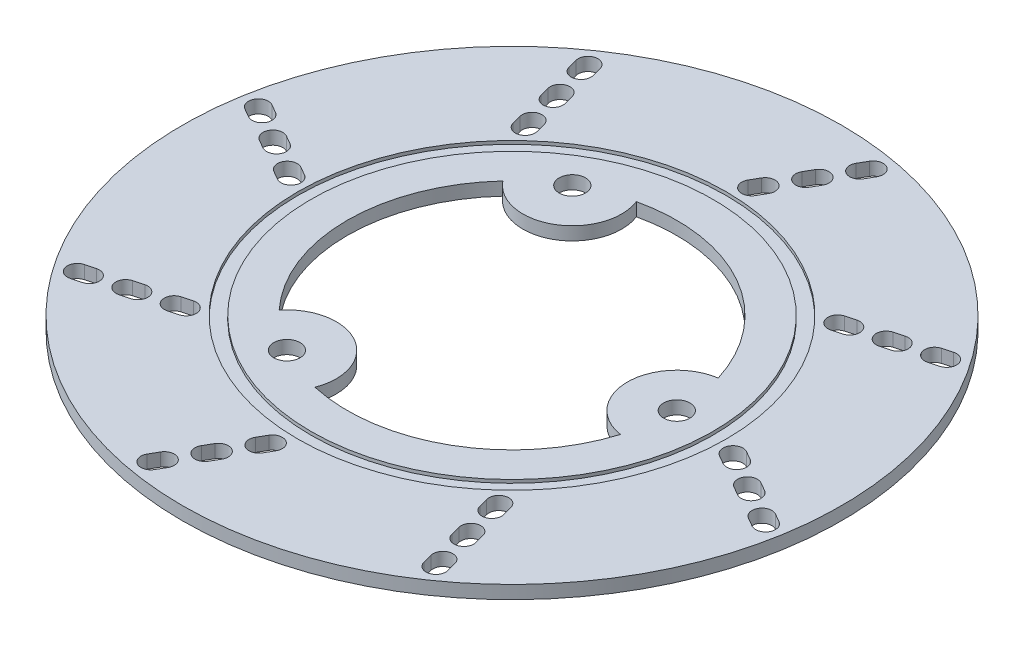
from build123d import *

# Parameters (mm, degrees)
SKETCH2_R           = 100
SKETCH2_R_2         = 4
BOSS_EXTRUDE1_DEPTH = 2
SKETCH3_R           = 65
SKETCH3_R_2         = 61
CUT_EXTRUDE2_DEPTH  = 1
CUT_EXTRUDE3_DEPTH  = 10


with BuildPart() as part:
    # Sketch2 → Boss-Extrude1 (new, symmetric)
    with BuildSketch(Plane(origin=(0, 0, 0), x_dir=(1, 0, 0), z_dir=(0, 1, 0))):
        Circle(SKETCH2_R)
        with Locations((50, 0)):
            Circle(SKETCH2_R_2, mode=Mode.SUBTRACT)
        with Locations((-25, -43.301270189)):
            Circle(SKETCH2_R_2, mode=Mode.SUBTRACT)
        with Locations((-25, 43.301270189)):
            Circle(SKETCH2_R_2, mode=Mode.SUBTRACT)
        with BuildLine():
            ThreePointArc((-36.718407842, 33.937568056), (-17.5, 30.310889132), (-11.031592158, 48.767858006))
            ThreePointArc((-11.031592158, 48.767858006), (25, 43.301270189), (47.75, 14.83028995))
            ThreePointArc((47.75, 14.83028995), (35, 0), (47.75, -14.83028995))
            ThreePointArc((47.75, -14.83028995), (25, -43.301270189), (-11.031592158, -48.767858006))
            ThreePointArc((-11.031592158, -48.767858006), (-17.5, -30.310889132), (-36.718407842, -33.937568056))
            ThreePointArc((-36.718407842, -33.937568056), (-50, 0), (-36.718407842, 33.937568056))
        make_face(mode=Mode.SUBTRACT)
    extrude(amount=BOSS_EXTRUDE1_DEPTH, both=True)

    # Sketch3 → Cut-Extrude2 (cut)
    with BuildSketch(Plane(origin=(0, 2, 0), x_dir=(1, 0, 0), z_dir=(0, 1, 0))):
        Circle(SKETCH3_R)
        Circle(SKETCH3_R_2, mode=Mode.SUBTRACT)
    extrude(amount=-CUT_EXTRUDE2_DEPTH, mode=Mode.SUBTRACT)

    # Sketch4 → Cut-Extrude3 (cut)
    with BuildSketch(Plane(origin=(0, 2, 0), x_dir=(1, 0, 0), z_dir=(0, 1, 0))):
        with BuildLine():
            Line((6.221861376, 81.776580022), (7.721861376, 84.374656233))
            ThreePointArc((7.721861376, 84.374656233), (11.819937588, 85.472732444), (12.918013799, 81.374656233))
            Line((12.918013799, 81.374656233), (11.418013799, 78.776580022))
            ThreePointArc((11.418013799, 78.776580022), (7.319937588, 77.67850381), (6.221861376, 81.776580022))
        make_face()
        with BuildLine():
            Line((0.221861376, 71.384275176), (1.721861376, 73.982351387))
            ThreePointArc((1.721861376, 73.982351387), (5.819937588, 75.080427599), (6.918013799, 70.982351387))
            Line((6.918013799, 70.982351387), (5.418013799, 68.384275176))
            ThreePointArc((5.418013799, 68.384275176), (1.319937588, 67.286198965), (0.221861376, 71.384275176))
        make_face()
        with BuildLine():
            Line((18.918013799, 91.766961078), (17.418013799, 89.168884867))
            ThreePointArc((17.418013799, 89.168884867), (13.319937588, 88.070808656), (12.221861376, 92.168884867))
            Line((12.221861376, 92.168884867), (13.721861376, 94.766961078))
            ThreePointArc((13.721861376, 94.766961078), (17.819937588, 95.86503729), (18.918013799, 91.766961078))
        make_face()
        with BuildLine():
            Line((-53.425253905, 62.224294646), (-54.20171104, 65.122072125))
            ThreePointArc((-54.20171104, 65.122072125), (-52.080390696, 68.796306739), (-48.406156082, 66.674986396))
            Line((-48.406156082, 66.674986396), (-47.629698947, 63.777208917))
            ThreePointArc((-47.629698947, 63.777208917), (-49.75101929, 60.102974303), (-53.425253905, 62.224294646))
        make_face()
        with BuildLine():
            Line((-50.319425363, 50.633184731), (-51.095882499, 53.53096221))
            ThreePointArc((-51.095882499, 53.53096221), (-48.974562155, 57.205196824), (-45.300327541, 55.08387648))
            Line((-45.300327541, 55.08387648), (-44.523870406, 52.186099001))
            ThreePointArc((-44.523870406, 52.186099001), (-46.645190749, 48.511864387), (-50.319425363, 50.633184731))
        make_face()
        with BuildLine():
            Line((-51.511984623, 78.266096311), (-50.735527488, 75.368318832))
            ThreePointArc((-50.735527488, 75.368318832), (-52.856847832, 71.694084218), (-56.531082446, 73.815404562))
            Line((-56.531082446, 73.815404562), (-57.307539581, 76.713182041))
            ThreePointArc((-57.307539581, 76.713182041), (-55.186219238, 80.387416655), (-51.511984623, 78.266096311))
        make_face()
        with BuildLine():
            Line((-81.776580022, 6.221861376), (-84.374656233, 7.721861376))
            ThreePointArc((-84.374656233, 7.721861376), (-85.472732444, 11.819937588), (-81.374656233, 12.918013799))
            Line((-81.374656233, 12.918013799), (-78.776580022, 11.418013799))
            ThreePointArc((-78.776580022, 11.418013799), (-77.67850381, 7.319937588), (-81.776580022, 6.221861376))
        make_face()
        with BuildLine():
            Line((-71.384275176, 0.221861376), (-73.982351387, 1.721861376))
            ThreePointArc((-73.982351387, 1.721861376), (-75.080427599, 5.819937588), (-70.982351387, 6.918013799))
            Line((-70.982351387, 6.918013799), (-68.384275176, 5.418013799))
            ThreePointArc((-68.384275176, 5.418013799), (-67.286198965, 1.319937588), (-71.384275176, 0.221861376))
        make_face()
        with BuildLine():
            Line((-91.766961078, 18.918013799), (-89.168884867, 17.418013799))
            ThreePointArc((-89.168884867, 17.418013799), (-88.070808656, 13.319937588), (-92.168884867, 12.221861376))
            Line((-92.168884867, 12.221861376), (-94.766961078, 13.721861376))
            ThreePointArc((-94.766961078, 13.721861376), (-95.86503729, 17.819937588), (-91.766961078, 18.918013799))
        make_face()
        with BuildLine():
            Line((-62.224294646, -53.425253905), (-65.122072125, -54.20171104))
            ThreePointArc((-65.122072125, -54.20171104), (-68.796306739, -52.080390696), (-66.674986396, -48.406156082))
            Line((-66.674986396, -48.406156082), (-63.777208917, -47.629698947))
            ThreePointArc((-63.777208917, -47.629698947), (-60.102974303, -49.75101929), (-62.224294646, -53.425253905))
        make_face()
        with BuildLine():
            Line((-50.633184731, -50.319425363), (-53.53096221, -51.095882499))
            ThreePointArc((-53.53096221, -51.095882499), (-57.205196824, -48.974562155), (-55.08387648, -45.300327541))
            Line((-55.08387648, -45.300327541), (-52.186099001, -44.523870406))
            ThreePointArc((-52.186099001, -44.523870406), (-48.511864387, -46.645190749), (-50.633184731, -50.319425363))
        make_face()
        with BuildLine():
            Line((-78.266096311, -51.511984623), (-75.368318832, -50.735527488))
            ThreePointArc((-75.368318832, -50.735527488), (-71.694084218, -52.856847832), (-73.815404562, -56.531082446))
            Line((-73.815404562, -56.531082446), (-76.713182041, -57.307539581))
            ThreePointArc((-76.713182041, -57.307539581), (-80.387416655, -55.186219238), (-78.266096311, -51.511984623))
        make_face()
        with BuildLine():
            Line((-6.221861376, -81.776580022), (-7.721861376, -84.374656233))
            ThreePointArc((-7.721861376, -84.374656233), (-11.819937588, -85.472732444), (-12.918013799, -81.374656233))
            Line((-12.918013799, -81.374656233), (-11.418013799, -78.776580022))
            ThreePointArc((-11.418013799, -78.776580022), (-7.319937588, -77.67850381), (-6.221861376, -81.776580022))
        make_face()
        with BuildLine():
            Line((-0.221861376, -71.384275176), (-1.721861376, -73.982351387))
            ThreePointArc((-1.721861376, -73.982351387), (-5.819937588, -75.080427599), (-6.918013799, -70.982351387))
            Line((-6.918013799, -70.982351387), (-5.418013799, -68.384275176))
            ThreePointArc((-5.418013799, -68.384275176), (-1.319937588, -67.286198965), (-0.221861376, -71.384275176))
        make_face()
        with BuildLine():
            Line((-18.918013799, -91.766961078), (-17.418013799, -89.168884867))
            ThreePointArc((-17.418013799, -89.168884867), (-13.319937588, -88.070808656), (-12.221861376, -92.168884867))
            Line((-12.221861376, -92.168884867), (-13.721861376, -94.766961078))
            ThreePointArc((-13.721861376, -94.766961078), (-17.819937588, -95.86503729), (-18.918013799, -91.766961078))
        make_face()
        with BuildLine():
            Line((53.425253905, -62.224294646), (54.20171104, -65.122072125))
            ThreePointArc((54.20171104, -65.122072125), (52.080390696, -68.796306739), (48.406156082, -66.674986396))
            Line((48.406156082, -66.674986396), (47.629698947, -63.777208917))
            ThreePointArc((47.629698947, -63.777208917), (49.75101929, -60.102974303), (53.425253905, -62.224294646))
        make_face()
        with BuildLine():
            Line((50.319425363, -50.633184731), (51.095882499, -53.53096221))
            ThreePointArc((51.095882499, -53.53096221), (48.974562155, -57.205196824), (45.300327541, -55.08387648))
            Line((45.300327541, -55.08387648), (44.523870406, -52.186099001))
            ThreePointArc((44.523870406, -52.186099001), (46.645190749, -48.511864387), (50.319425363, -50.633184731))
        make_face()
        with BuildLine():
            Line((51.511984623, -78.266096311), (50.735527488, -75.368318832))
            ThreePointArc((50.735527488, -75.368318832), (52.856847832, -71.694084218), (56.531082446, -73.815404562))
            Line((56.531082446, -73.815404562), (57.307539581, -76.713182041))
            ThreePointArc((57.307539581, -76.713182041), (55.186219238, -80.387416655), (51.511984623, -78.266096311))
        make_face()
        with BuildLine():
            Line((81.776580022, -6.221861376), (84.374656233, -7.721861376))
            ThreePointArc((84.374656233, -7.721861376), (85.472732444, -11.819937588), (81.374656233, -12.918013799))
            Line((81.374656233, -12.918013799), (78.776580022, -11.418013799))
            ThreePointArc((78.776580022, -11.418013799), (77.67850381, -7.319937588), (81.776580022, -6.221861376))
        make_face()
        with BuildLine():
            Line((71.384275176, -0.221861376), (73.982351387, -1.721861376))
            ThreePointArc((73.982351387, -1.721861376), (75.080427599, -5.819937588), (70.982351387, -6.918013799))
            Line((70.982351387, -6.918013799), (68.384275176, -5.418013799))
            ThreePointArc((68.384275176, -5.418013799), (67.286198965, -1.319937588), (71.384275176, -0.221861376))
        make_face()
        with BuildLine():
            Line((91.766961078, -18.918013799), (89.168884867, -17.418013799))
            ThreePointArc((89.168884867, -17.418013799), (88.070808656, -13.319937588), (92.168884867, -12.221861376))
            Line((92.168884867, -12.221861376), (94.766961078, -13.721861376))
            ThreePointArc((94.766961078, -13.721861376), (95.86503729, -17.819937588), (91.766961078, -18.918013799))
        make_face()
        with BuildLine():
            Line((62.224294646, 53.425253905), (65.122072125, 54.20171104))
            ThreePointArc((65.122072125, 54.20171104), (68.796306739, 52.080390696), (66.674986396, 48.406156082))
            Line((66.674986396, 48.406156082), (63.777208917, 47.629698947))
            ThreePointArc((63.777208917, 47.629698947), (60.102974303, 49.75101929), (62.224294646, 53.425253905))
        make_face()
        with BuildLine():
            Line((50.633184731, 50.319425363), (53.53096221, 51.095882499))
            ThreePointArc((53.53096221, 51.095882499), (57.205196824, 48.974562155), (55.08387648, 45.300327541))
            Line((55.08387648, 45.300327541), (52.186099001, 44.523870406))
            ThreePointArc((52.186099001, 44.523870406), (48.511864387, 46.645190749), (50.633184731, 50.319425363))
        make_face()
        with BuildLine():
            Line((78.266096311, 51.511984623), (75.368318832, 50.735527488))
            ThreePointArc((75.368318832, 50.735527488), (71.694084218, 52.856847832), (73.815404562, 56.531082446))
            Line((73.815404562, 56.531082446), (76.713182041, 57.307539581))
            ThreePointArc((76.713182041, 57.307539581), (80.387416655, 55.186219238), (78.266096311, 51.511984623))
        make_face()
    extrude(amount=-CUT_EXTRUDE3_DEPTH, mode=Mode.SUBTRACT)


solid = part.part
